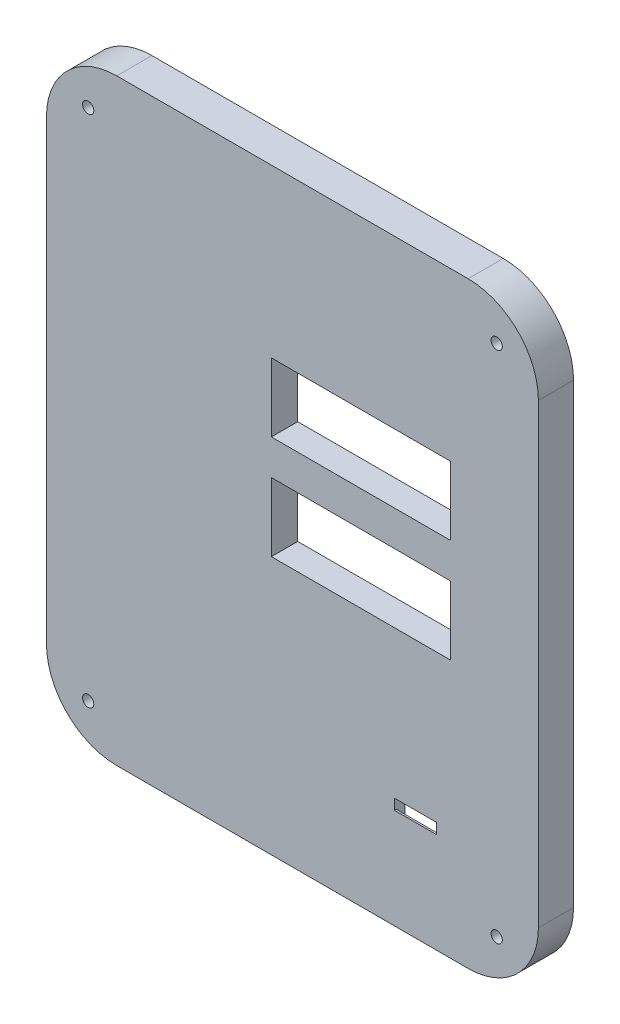
from build123d import *

# Parameters (mm, degrees)
BOSS_EXTRUDE1_DEPTH              = 10
SHELL1_T                         = -4
SHELL1_THICKNESS_2_DEPTH         = 1
SKETCH2_R                        = 1.6
BOSS_EXTRUDE2_DEPTH              = 7
SKETCH2_3_R                      = 1.6
CUT_EXTRUDE1_DEPTH               = 125.980205512
MIRROR7_COPY_1_SKETCH_R          = 1.6
MIRROR7_COPY_1_DEPTH             = 7
MIRROR7_COPY_2_SKETCH_R          = 1.6
MIRROR7_COPY_2_DEPTH             = 125.980205512
BOSS_EXTRUDE3_DEPTH              = 7
BOSS_EXTRUDE4_START              = 2
BOSS_EXTRUDE4_DEPTH              = 2
SKETCH4_W                        = 51
SKETCH4_H                        = 19.5
CUT_EXTRUDE2_DEPTH               = 125.904170346
SKETCH5_R                        = 2.2
SKETCH5_W                        = 51
SKETCH5_H                        = 19.5
BOSS_EXTRUDE5_DEPTH              = 4.5
SKETCH6_W                        = 2.74
SKETCH6_H                        = 10.36
CUT_EXTRUDE3_DEPTH               = 3
CUT_EXTRUDE4_START               = 4.5
SKETCH5_3_R                      = 2.2
CUT_EXTRUDE4_DEPTH               = 4.5
CHAMFER1_SIZE                    = 0.5
CHAMFER1_OF_SKETCH_PATTERN1_SIZE = 0.5
SKETCH7_W                        = 12
SKETCH7_H                        = 12
CUT_EXTRUDE5_DEPTH               = 2.5
SKETCH7_3_W                      = 12
SKETCH7_3_H                      = 3
CUT_EXTRUDE6_DEPTH               = 125.904170346


with BuildPart() as part:
    # Sketch1 → Boss-Extrude1 (new body)
    with BuildSketch(Plane.XY):
        with BuildLine():
            Line((-47.122691811, 101.03934739), (52.877308189, 101.03934739))
            ThreePointArc((52.877308189, 101.03934739), (67.019443812, 95.181483014), (72.877308189, 81.03934739))
            Line((72.877308189, 81.03934739), (72.877308189, -48.96065261))
            ThreePointArc((72.877308189, -48.96065261), (67.019443812, -63.102788233), (52.877308189, -68.96065261))
            Line((52.877308189, -68.96065261), (-47.122691811, -68.96065261))
            ThreePointArc((-47.122691811, -68.96065261), (-61.264827435, -63.102788233), (-67.122691811, -48.96065261))
            Line((-67.122691811, -48.96065261), (-67.122691811, 81.03934739))
            ThreePointArc((-67.122691811, 81.03934739), (-61.264827435, 95.181483014), (-47.122691811, 101.03934739))
        make_face()
    extrude(amount=BOSS_EXTRUDE1_DEPTH)

    # Shell1
    shell1_openings = [part.faces().sort_by_distance(p)[0] for p in [
        (2.877308189, 16.03934739, 0),
    ]]
    offset(amount=SHELL1_T, openings=shell1_openings, kind=Kind.INTERSECTION)

    # Shell1 thickness 2 face (on inner face of the shell) → Shell1 thickness 2 (cut)
    with BuildSketch(Plane(origin=(2.877308189, 16.03934739, 6), x_dir=(1, 0, 0), z_dir=(0, 0, 1))):
        with BuildLine():
            Line((-50, 81), (50, 81))
            ThreePointArc((50, 81), (61.313708499, 76.313708499), (66, 65))
            Line((66, 65), (66, -65))
            ThreePointArc((66, -65), (61.313708499, -76.313708499), (50, -81))
            Line((50, -81), (-50, -81))
            ThreePointArc((-50, -81), (-61.313708499, -76.313708499), (-66, -65))
            Line((-66, -65), (-66, 65))
            ThreePointArc((-66, 65), (-61.313708499, 76.313708499), (-50, 81))
        make_face()
    extrude(amount=SHELL1_THICKNESS_2_DEPTH, mode=Mode.SUBTRACT)

    # Sketch2 → Boss-Extrude2 (add)
    # profile 1 of 2: a face of its own
    with BuildSketch(Plane(origin=(0, 0, 0), x_dir=(-1, 0, 0), z_dir=(0, 0, -1))):
        with BuildLine():
            ThreePointArc((45.118506928, 97.03934739), (46.785015828, 96.533891053), (47.889959739, 95.187846115))
            Line((47.889959739, 95.187846115), (51.097240579, 87.448327288))
            ThreePointArc((51.097240579, 87.448327288), (52.07243928, 85.989094859), (53.531671708, 85.013896159))
            Line((53.531671708, 85.013896159), (61.271190536, 81.806615318))
            ThreePointArc((61.271190536, 81.806615318), (62.617235474, 80.701671407), (63.122691811, 79.035162507))
            Line((63.122691811, 79.035162507), (63.122691811, 81.03934739))
            ThreePointArc((63.122691811, 81.03934739), (58.43640031, 92.353055889), (47.122691811, 97.03934739))
            Line((47.122691811, 97.03934739), (45.118506928, 97.03934739))
        make_face()
        with Locations((55.254419795, 89.171075374)):
            Circle(SKETCH2_R, mode=Mode.SUBTRACT)
    # profile 2 of 2: a face of its own
    with BuildSketch(Plane(origin=(0, 0, 0), x_dir=(-1, 0, 0), z_dir=(0, 0, -1))):
        with Locations((55.254419795, 89.171075374)):
            Circle(SKETCH2_R)
    boss_extrude2 = extrude(amount=-BOSS_EXTRUDE2_DEPTH)

    # Sketch2<3> → Cut-Extrude1 (cut, through all)
    with BuildSketch(Plane(origin=(0, 0, 0), x_dir=(-1, 0, 0), z_dir=(0, 0, -1))):
        with Locations((55.254419795, 89.171075374)):
            Circle(SKETCH2_3_R)
    cut_extrude1 = extrude(amount=-CUT_EXTRUDE1_DEPTH, mode=Mode.SUBTRACT)

    # Mirror6: Boss-Extrude2, Cut-Extrude1 across plane
    add(boss_extrude2.mirror(Plane.ZX.offset(16.03934739)))
    add(cut_extrude1.mirror(Plane.ZX.offset(16.03934739)), mode=Mode.SUBTRACT)

    # Mirror7: Boss-Extrude2, Cut-Extrude1 across plane
    add(boss_extrude2.mirror(Plane(origin=(2.877308189, 0, 0), x_dir=(0, 0, 1), z_dir=(1, 0, 0))))
    add(cut_extrude1.mirror(Plane(origin=(2.877308189, 0, 0), x_dir=(0, 0, 1), z_dir=(1, 0, 0))), mode=Mode.SUBTRACT)

    # Mirror7 copy 1 sketch → Mirror7 copy 1 (add)
    # profile 1 of 2: a face of its own
    with BuildSketch(Plane(origin=(5.754616377, 32.078694781, 0), x_dir=(1, 0, 0), z_dir=(0, 0, -1))):
        with BuildLine():
            ThreePointArc((45.118506928, 97.03934739), (46.785015828, 96.533891053), (47.889959739, 95.187846115))
            Line((47.889959739, 95.187846115), (51.097240579, 87.448327288))
            ThreePointArc((51.097240579, 87.448327288), (52.07243928, 85.989094859), (53.531671708, 85.013896159))
            Line((53.531671708, 85.013896159), (61.271190536, 81.806615318))
            ThreePointArc((61.271190536, 81.806615318), (62.617235474, 80.701671407), (63.122691811, 79.035162507))
            Line((63.122691811, 79.035162507), (63.122691811, 81.03934739))
            ThreePointArc((63.122691811, 81.03934739), (58.43640031, 92.353055889), (47.122691811, 97.03934739))
            Line((47.122691811, 97.03934739), (45.118506928, 97.03934739))
        make_face()
        with Locations((55.254419795, 89.171075374)):
            Circle(MIRROR7_COPY_1_SKETCH_R, mode=Mode.SUBTRACT)
    # profile 2 of 2: a face of its own
    with BuildSketch(Plane(origin=(5.754616377, 32.078694781, 0), x_dir=(1, 0, 0), z_dir=(0, 0, -1))):
        with Locations((55.254419795, 89.171075374)):
            Circle(MIRROR7_COPY_1_SKETCH_R)
    extrude(amount=-MIRROR7_COPY_1_DEPTH)

    # Mirror7 copy 2 sketch → Mirror7 copy 2 (cut, through all)
    with BuildSketch(Plane(origin=(5.754616377, 32.078694781, 0), x_dir=(1, 0, 0), z_dir=(0, 0, -1))):
        with Locations((55.254419795, 89.171075374)):
            Circle(MIRROR7_COPY_2_SKETCH_R)
    extrude(amount=-MIRROR7_COPY_2_DEPTH, mode=Mode.SUBTRACT)

    # Sketch3 → Boss-Extrude3 (add)
    # profile 1 of 2: a face of its own
    with BuildSketch(Plane(origin=(0, 0, 0), x_dir=(-1, 0, 0), z_dir=(0, 0, -1))):
        with BuildLine():
            ThreePointArc((-53.644576116, 95.187846115), (-52.539632205, 96.533891053), (-50.873123306, 97.03934739))
            Line((-50.873123306, 97.03934739), (45.118506928, 97.03934739))
            ThreePointArc((45.118506928, 97.03934739), (46.785015828, 96.533891053), (47.889959739, 95.187846115))
            Line((47.889959739, 95.187846115), (51.097240579, 87.448327288))
            ThreePointArc((51.097240579, 87.448327288), (52.07243928, 85.989094859), (53.531671708, 85.013896159))
            Line((53.531671708, 85.013896159), (61.271190536, 81.806615318))
            ThreePointArc((61.271190536, 81.806615318), (62.617235474, 80.701671407), (63.122691811, 79.035162507))
            Line((63.122691811, 79.035162507), (63.122691811, -46.956467726))
            ThreePointArc((63.122691811, -46.956467726), (62.617235474, -48.622976626), (61.271190536, -49.727920537))
            Line((61.271190536, -49.727920537), (53.531671708, -52.935201378))
            ThreePointArc((53.531671708, -52.935201378), (52.07243928, -53.910400078), (51.097240579, -55.369632507))
            Line((51.097240579, -55.369632507), (47.889959739, -63.109151334))
            ThreePointArc((47.889959739, -63.109151334), (46.785015828, -64.455196273), (45.118506928, -64.96065261))
            Line((45.118506928, -64.96065261), (-50.873123306, -64.96065261))
            ThreePointArc((-50.873123306, -64.96065261), (-52.539632205, -64.455196273), (-53.644576116, -63.109151334))
            Line((-53.644576116, -63.109151334), (-56.851856957, -55.369632507))
            ThreePointArc((-56.851856957, -55.369632507), (-57.827055657, -53.910400078), (-59.286288086, -52.935201378))
            Line((-59.286288086, -52.935201378), (-67.025806913, -49.727920537))
            ThreePointArc((-67.025806913, -49.727920537), (-68.371851852, -48.622976626), (-68.877308189, -46.956467726))
            Line((-68.877308189, -46.956467726), (-68.877308189, 79.035162507))
            ThreePointArc((-68.877308189, 79.035162507), (-68.371851852, 80.701671407), (-67.025806913, 81.806615318))
            Line((-67.025806913, 81.806615318), (-59.286288086, 85.013896159))
            ThreePointArc((-59.286288086, 85.013896159), (-57.827055657, 85.989094859), (-56.851856957, 87.448327288))
            Line((-56.851856957, 87.448327288), (-53.644576116, 95.187846115))
        make_face()
        with BuildLine():
            ThreePointArc((45.118506928, -64.46065261), (46.507264345, -64.039438995), (47.428050937, -62.91773488))
            Line((47.428050937, -62.91773488), (50.635331778, -55.178216053))
            ThreePointArc((50.635331778, -55.178216053), (51.718885889, -53.556846687), (53.340255254, -52.473292576))
            Line((53.340255254, -52.473292576), (61.079774082, -49.266011735))
            ThreePointArc((61.079774082, -49.266011735), (62.201478197, -48.345225143), (62.622691811, -46.956467726))
            Line((62.622691811, -46.956467726), (62.622691811, 79.035162507))
            ThreePointArc((62.622691811, 79.035162507), (62.201478197, 80.423919924), (61.079774082, 81.344706516))
            Line((61.079774082, 81.344706516), (53.340255254, 84.551987357))
            ThreePointArc((53.340255254, 84.551987357), (51.718885889, 85.635541468), (50.635331778, 87.256910834))
            Line((50.635331778, 87.256910834), (47.428050937, 94.996429661))
            ThreePointArc((47.428050937, 94.996429661), (46.507264345, 96.118133776), (45.118506928, 96.53934739))
            Line((45.118506928, 96.53934739), (-50.873123306, 96.53934739))
            ThreePointArc((-50.873123306, 96.53934739), (-52.261880722, 96.118133776), (-53.182667314, 94.996429661))
            Line((-53.182667314, 94.996429661), (-56.389948155, 87.256910834))
            ThreePointArc((-56.389948155, 87.256910834), (-57.473502266, 85.635541468), (-59.094871632, 84.551987357))
            Line((-59.094871632, 84.551987357), (-66.834390459, 81.344706516))
            ThreePointArc((-66.834390459, 81.344706516), (-67.956094575, 80.423919924), (-68.377308189, 79.035162507))
            Line((-68.377308189, 79.035162507), (-68.377308189, -46.956467726))
            ThreePointArc((-68.377308189, -46.956467726), (-67.956094575, -48.345225143), (-66.834390459, -49.266011735))
            Line((-66.834390459, -49.266011735), (-59.094871632, -52.473292576))
            ThreePointArc((-59.094871632, -52.473292576), (-57.473502266, -53.556846687), (-56.389948155, -55.178216053))
            Line((-56.389948155, -55.178216053), (-53.182667314, -62.91773488))
            ThreePointArc((-53.182667314, -62.91773488), (-52.261880722, -64.039438995), (-50.873123306, -64.46065261))
            Line((-50.873123306, -64.46065261), (45.118506928, -64.46065261))
        make_face(mode=Mode.SUBTRACT)
    # profile 2 of 2: a face of its own
    with BuildSketch(Plane(origin=(0, 0, 0), x_dir=(-1, 0, 0), z_dir=(0, 0, -1))):
        with BuildLine():
            Line((45.118506928, -64.46065261), (-50.873123306, -64.46065261))
            ThreePointArc((-50.873123306, -64.46065261), (-52.261880722, -64.039438995), (-53.182667314, -62.91773488))
            Line((-53.182667314, -62.91773488), (-56.389948155, -55.178216053))
            ThreePointArc((-56.389948155, -55.178216053), (-57.473502266, -53.556846687), (-59.094871632, -52.473292576))
            Line((-59.094871632, -52.473292576), (-66.834390459, -49.266011735))
            ThreePointArc((-66.834390459, -49.266011735), (-67.956094575, -48.345225143), (-68.377308189, -46.956467726))
            Line((-68.377308189, -46.956467726), (-68.377308189, 79.035162507))
            ThreePointArc((-68.377308189, 79.035162507), (-67.956094575, 80.423919924), (-66.834390459, 81.344706516))
            Line((-66.834390459, 81.344706516), (-59.094871632, 84.551987357))
            ThreePointArc((-59.094871632, 84.551987357), (-57.473502266, 85.635541468), (-56.389948155, 87.256910834))
            Line((-56.389948155, 87.256910834), (-53.182667314, 94.996429661))
            ThreePointArc((-53.182667314, 94.996429661), (-52.261880722, 96.118133776), (-50.873123306, 96.53934739))
            Line((-50.873123306, 96.53934739), (45.118506928, 96.53934739))
            ThreePointArc((45.118506928, 96.53934739), (46.507264345, 96.118133776), (47.428050937, 94.996429661))
            Line((47.428050937, 94.996429661), (50.635331778, 87.256910834))
            ThreePointArc((50.635331778, 87.256910834), (51.718885889, 85.635541468), (53.340255254, 84.551987357))
            Line((53.340255254, 84.551987357), (61.079774082, 81.344706516))
            ThreePointArc((61.079774082, 81.344706516), (62.201478197, 80.423919924), (62.622691811, 79.035162507))
            Line((62.622691811, 79.035162507), (62.622691811, -46.956467726))
            ThreePointArc((62.622691811, -46.956467726), (62.201478197, -48.345225143), (61.079774082, -49.266011735))
            Line((61.079774082, -49.266011735), (53.340255254, -52.473292576))
            ThreePointArc((53.340255254, -52.473292576), (51.718885889, -53.556846687), (50.635331778, -55.178216053))
            Line((50.635331778, -55.178216053), (47.428050937, -62.91773488))
            ThreePointArc((47.428050937, -62.91773488), (46.507264345, -64.039438995), (45.118506928, -64.46065261))
        make_face()
        with BuildLine():
            ThreePointArc((45.118506928, -62.46065261), (45.396258411, -62.376409887), (45.58041573, -62.152069064))
            Line((45.58041573, -62.152069064), (48.787696571, -54.412550236))
            ThreePointArc((48.787696571, -54.412550236), (50.304672327, -52.142633125), (52.574589438, -50.625657369))
            Line((52.574589438, -50.625657369), (60.314108265, -47.418376528))
            ThreePointArc((60.314108265, -47.418376528), (60.538449088, -47.23421921), (60.622691811, -46.956467726))
            Line((60.622691811, -46.956467726), (60.622691811, 79.035162507))
            ThreePointArc((60.622691811, 79.035162507), (60.538449088, 79.312913991), (60.314108265, 79.497071309))
            Line((60.314108265, 79.497071309), (52.574589438, 82.70435215))
            ThreePointArc((52.574589438, 82.70435215), (50.304672327, 84.221327906), (48.787696571, 86.491245017))
            Line((48.787696571, 86.491245017), (45.58041573, 94.230763844))
            ThreePointArc((45.58041573, 94.230763844), (45.396258411, 94.455104668), (45.118506928, 94.53934739))
            Line((45.118506928, 94.53934739), (-50.873123306, 94.53934739))
            ThreePointArc((-50.873123306, 94.53934739), (-51.150874789, 94.455104668), (-51.335032107, 94.230763844))
            Line((-51.335032107, 94.230763844), (-54.542312948, 86.491245017))
            ThreePointArc((-54.542312948, 86.491245017), (-56.059288704, 84.221327906), (-58.329205816, 82.70435215))
            Line((-58.329205816, 82.70435215), (-66.068724643, 79.497071309))
            ThreePointArc((-66.068724643, 79.497071309), (-66.293065466, 79.312913991), (-66.377308189, 79.035162507))
            Line((-66.377308189, 79.035162507), (-66.377308189, -46.956467726))
            ThreePointArc((-66.377308189, -46.956467726), (-66.293065466, -47.23421921), (-66.068724643, -47.418376528))
            Line((-66.068724643, -47.418376528), (-58.329205816, -50.625657369))
            ThreePointArc((-58.329205816, -50.625657369), (-56.059288704, -52.142633125), (-54.542312948, -54.412550236))
            Line((-54.542312948, -54.412550236), (-51.335032107, -62.152069064))
            ThreePointArc((-51.335032107, -62.152069064), (-51.150874789, -62.376409887), (-50.873123306, -62.46065261))
            Line((-50.873123306, -62.46065261), (45.118506928, -62.46065261))
        make_face(mode=Mode.SUBTRACT)
    extrude(amount=-BOSS_EXTRUDE3_DEPTH)

    # Sketch3<3> → Boss-Extrude4 (add)
    with BuildSketch(Plane(origin=(0, 0, 0), x_dir=(-1, 0, 0), z_dir=(0, 0, -1)).offset(BOSS_EXTRUDE4_START)):
        with BuildLine():
            Line((45.118506928, -64.46065261), (-50.873123306, -64.46065261))
            ThreePointArc((-50.873123306, -64.46065261), (-52.261880722, -64.039438995), (-53.182667314, -62.91773488))
            Line((-53.182667314, -62.91773488), (-56.389948155, -55.178216053))
            ThreePointArc((-56.389948155, -55.178216053), (-57.473502266, -53.556846687), (-59.094871632, -52.473292576))
            Line((-59.094871632, -52.473292576), (-66.834390459, -49.266011735))
            ThreePointArc((-66.834390459, -49.266011735), (-67.956094575, -48.345225143), (-68.377308189, -46.956467726))
            Line((-68.377308189, -46.956467726), (-68.377308189, 79.035162507))
            ThreePointArc((-68.377308189, 79.035162507), (-67.956094575, 80.423919924), (-66.834390459, 81.344706516))
            Line((-66.834390459, 81.344706516), (-59.094871632, 84.551987357))
            ThreePointArc((-59.094871632, 84.551987357), (-57.473502266, 85.635541468), (-56.389948155, 87.256910834))
            Line((-56.389948155, 87.256910834), (-53.182667314, 94.996429661))
            ThreePointArc((-53.182667314, 94.996429661), (-52.261880722, 96.118133776), (-50.873123306, 96.53934739))
            Line((-50.873123306, 96.53934739), (45.118506928, 96.53934739))
            ThreePointArc((45.118506928, 96.53934739), (46.507264345, 96.118133776), (47.428050937, 94.996429661))
            Line((47.428050937, 94.996429661), (50.635331778, 87.256910834))
            ThreePointArc((50.635331778, 87.256910834), (51.718885889, 85.635541468), (53.340255254, 84.551987357))
            Line((53.340255254, 84.551987357), (61.079774082, 81.344706516))
            ThreePointArc((61.079774082, 81.344706516), (62.201478197, 80.423919924), (62.622691811, 79.035162507))
            Line((62.622691811, 79.035162507), (62.622691811, -46.956467726))
            ThreePointArc((62.622691811, -46.956467726), (62.201478197, -48.345225143), (61.079774082, -49.266011735))
            Line((61.079774082, -49.266011735), (53.340255254, -52.473292576))
            ThreePointArc((53.340255254, -52.473292576), (51.718885889, -53.556846687), (50.635331778, -55.178216053))
            Line((50.635331778, -55.178216053), (47.428050937, -62.91773488))
            ThreePointArc((47.428050937, -62.91773488), (46.507264345, -64.039438995), (45.118506928, -64.46065261))
        make_face()
        with BuildLine():
            ThreePointArc((45.118506928, -62.46065261), (45.396258411, -62.376409887), (45.58041573, -62.152069064))
            Line((45.58041573, -62.152069064), (48.787696571, -54.412550236))
            ThreePointArc((48.787696571, -54.412550236), (50.304672327, -52.142633125), (52.574589438, -50.625657369))
            Line((52.574589438, -50.625657369), (60.314108265, -47.418376528))
            ThreePointArc((60.314108265, -47.418376528), (60.538449088, -47.23421921), (60.622691811, -46.956467726))
            Line((60.622691811, -46.956467726), (60.622691811, 79.035162507))
            ThreePointArc((60.622691811, 79.035162507), (60.538449088, 79.312913991), (60.314108265, 79.497071309))
            Line((60.314108265, 79.497071309), (52.574589438, 82.70435215))
            ThreePointArc((52.574589438, 82.70435215), (50.304672327, 84.221327906), (48.787696571, 86.491245017))
            Line((48.787696571, 86.491245017), (45.58041573, 94.230763844))
            ThreePointArc((45.58041573, 94.230763844), (45.396258411, 94.455104668), (45.118506928, 94.53934739))
            Line((45.118506928, 94.53934739), (-50.873123306, 94.53934739))
            ThreePointArc((-50.873123306, 94.53934739), (-51.150874789, 94.455104668), (-51.335032107, 94.230763844))
            Line((-51.335032107, 94.230763844), (-54.542312948, 86.491245017))
            ThreePointArc((-54.542312948, 86.491245017), (-56.059288704, 84.221327906), (-58.329205816, 82.70435215))
            Line((-58.329205816, 82.70435215), (-66.068724643, 79.497071309))
            ThreePointArc((-66.068724643, 79.497071309), (-66.293065466, 79.312913991), (-66.377308189, 79.035162507))
            Line((-66.377308189, 79.035162507), (-66.377308189, -46.956467726))
            ThreePointArc((-66.377308189, -46.956467726), (-66.293065466, -47.23421921), (-66.068724643, -47.418376528))
            Line((-66.068724643, -47.418376528), (-58.329205816, -50.625657369))
            ThreePointArc((-58.329205816, -50.625657369), (-56.059288704, -52.142633125), (-54.542312948, -54.412550236))
            Line((-54.542312948, -54.412550236), (-51.335032107, -62.152069064))
            ThreePointArc((-51.335032107, -62.152069064), (-51.150874789, -62.376409887), (-50.873123306, -62.46065261))
            Line((-50.873123306, -62.46065261), (45.118506928, -62.46065261))
        make_face(mode=Mode.SUBTRACT)
    extrude(amount=-BOSS_EXTRUDE4_DEPTH)

    # Sketch4 → Cut-Extrude2 (cut, through all)
    with BuildSketch(Plane(origin=(0, 0, 7), x_dir=(-1, 0, 0), z_dir=(0, 0, -1))):
        with Locations((-22.377308189, 14.28934739)):
            Rectangle(SKETCH4_W, SKETCH4_H)
        with Locations((-22.377308189, 43.78934739)):
            Rectangle(SKETCH4_W, SKETCH4_H)
    extrude(amount=-CUT_EXTRUDE2_DEPTH, mode=Mode.SUBTRACT)

    # Sketch5 → Boss-Extrude5 (add)
    # profile 1 of 5: a face of its own
    with BuildSketch(Plane(origin=(0, 0, 7), x_dir=(-1, 0, 0), z_dir=(0, 0, -1))):
        with BuildLine():
            Line((-56.977308189, 26.88934739), (-56.977308189, 1.68934739))
            ThreePointArc((-56.977308189, 1.68934739), (-56.68441497, 0.982240609), (-55.977308189, 0.68934739))
            Line((-55.977308189, 0.68934739), (8.022691811, 0.68934739))
            ThreePointArc((8.022691811, 0.68934739), (8.729798592, 0.982240609), (9.022691811, 1.68934739))
            Line((9.022691811, 1.68934739), (9.022691811, 26.88934739))
            ThreePointArc((9.022691811, 26.88934739), (8.729798592, 27.596454172), (8.022691811, 27.88934739))
            Line((8.022691811, 27.88934739), (-55.977308189, 27.88934739))
            ThreePointArc((-55.977308189, 27.88934739), (-56.68441497, 27.596454172), (-56.977308189, 26.88934739))
        make_face()
        with Locations((-53.977308189, 3.53934739)):
            Circle(SKETCH5_R, mode=Mode.SUBTRACT)
        with Locations((-53.977308189, 25.03934739)):
            Circle(SKETCH5_R, mode=Mode.SUBTRACT)
        with Locations((6.022691811, 3.53934739)):
            Circle(SKETCH5_R, mode=Mode.SUBTRACT)
        with Locations((6.022691811, 25.03934739)):
            Circle(SKETCH5_R, mode=Mode.SUBTRACT)
        with Locations((-22.377308189, 14.28934739)):
            Rectangle(SKETCH5_W, SKETCH5_H, mode=Mode.SUBTRACT)
    # profile 2 of 5: a face of its own
    with BuildSketch(Plane(origin=(0, 0, 7), x_dir=(-1, 0, 0), z_dir=(0, 0, -1))):
        with Locations((6.022691811, 3.53934739)):
            Circle(SKETCH5_R)
    # profile 3 of 5: a face of its own
    with BuildSketch(Plane(origin=(0, 0, 7), x_dir=(-1, 0, 0), z_dir=(0, 0, -1))):
        with Locations((6.022691811, 25.03934739)):
            Circle(SKETCH5_R)
    # profile 4 of 5: a face of its own
    with BuildSketch(Plane(origin=(0, 0, 7), x_dir=(-1, 0, 0), z_dir=(0, 0, -1))):
        with Locations((-53.977308189, 25.03934739)):
            Circle(SKETCH5_R)
    # profile 5 of 5: a face of its own
    with BuildSketch(Plane(origin=(0, 0, 7), x_dir=(-1, 0, 0), z_dir=(0, 0, -1))):
        with Locations((-53.977308189, 3.53934739)):
            Circle(SKETCH5_R)
    boss_extrude5 = extrude(amount=BOSS_EXTRUDE5_DEPTH)

    # Sketch6 → Cut-Extrude3 (cut)
    with BuildSketch(Plane(origin=(0, 0, 2.5), x_dir=(-1, 0, 0), z_dir=(0, 0, -1))):
        with Locations((-50.777308189, 13.77934739)):
            Rectangle(SKETCH6_W, SKETCH6_H)
        with Locations((6.022691811, 13.77934739)):
            Rectangle(SKETCH6_W, SKETCH6_H)
    cut_extrude3 = extrude(amount=-CUT_EXTRUDE3_DEPTH, mode=Mode.SUBTRACT)

    # Sketch5<3> → Cut-Extrude4 (cut)
    with BuildSketch(Plane(origin=(0, 0, 7), x_dir=(-1, 0, 0), z_dir=(0, 0, -1)).offset(CUT_EXTRUDE4_START)):
        with Locations((6.022691811, 3.53934739)):
            Circle(SKETCH5_3_R)
        with Locations((6.022691811, 25.03934739)):
            Circle(SKETCH5_3_R)
        with Locations((-53.977308189, 25.03934739)):
            Circle(SKETCH5_3_R)
        with Locations((-53.977308189, 3.53934739)):
            Circle(SKETCH5_3_R)
    cut_extrude4 = extrude(amount=-CUT_EXTRUDE4_DEPTH, mode=Mode.SUBTRACT)

    # Chamfer1
    chamfer1_edges = [part.edges().sort_by_distance(p)[0] for p in [
        (56.177308189, 3.53934739, 2.5),
        (56.177308189, 25.03934739, 2.5),
        (-3.822691811, 25.03934739, 2.5),
        (-3.822691811, 3.53934739, 2.5),
    ]]
    chamfer(chamfer1_edges, length=CHAMFER1_SIZE)

    # Sketch-Pattern1: Boss-Extrude5, Cut-Extrude3, Cut-Extrude4 at 1 more place
    with Locations((0, 29.5, 0)):
        add(boss_extrude5)
        add(cut_extrude3, mode=Mode.SUBTRACT)
        add(cut_extrude4, mode=Mode.SUBTRACT)

    # Chamfer1 of Sketch-Pattern1
    chamfer1_of_sketch_pattern1_edges = [part.edges().sort_by_distance(p)[0] for p in [
        (56.177308189, 33.03934739, 2.5),
        (56.177308189, 54.53934739, 2.5),
        (-3.822691811, 54.53934739, 2.5),
        (-3.822691811, 33.03934739, 2.5),
    ]]
    chamfer(chamfer1_of_sketch_pattern1_edges, length=CHAMFER1_OF_SKETCH_PATTERN1_SIZE)

    # Sketch7 → Cut-Extrude5 (cut)
    with BuildSketch(Plane(origin=(0, 0, 7), x_dir=(-1, 0, 0), z_dir=(0, 0, -1))):
        with Locations((-37.877308189, -46.46065261)):
            Rectangle(SKETCH7_W, SKETCH7_H)
    extrude(amount=-CUT_EXTRUDE5_DEPTH, mode=Mode.SUBTRACT)

    # Sketch7<3> → Cut-Extrude6 (cut, through all)
    with BuildSketch(Plane(origin=(0, 0, 7), x_dir=(-1, 0, 0), z_dir=(0, 0, -1))):
        with Locations((-37.877308189, -38.96065261)):
            Rectangle(SKETCH7_3_W, SKETCH7_3_H)
    extrude(amount=-CUT_EXTRUDE6_DEPTH, mode=Mode.SUBTRACT)


solid = part.part
